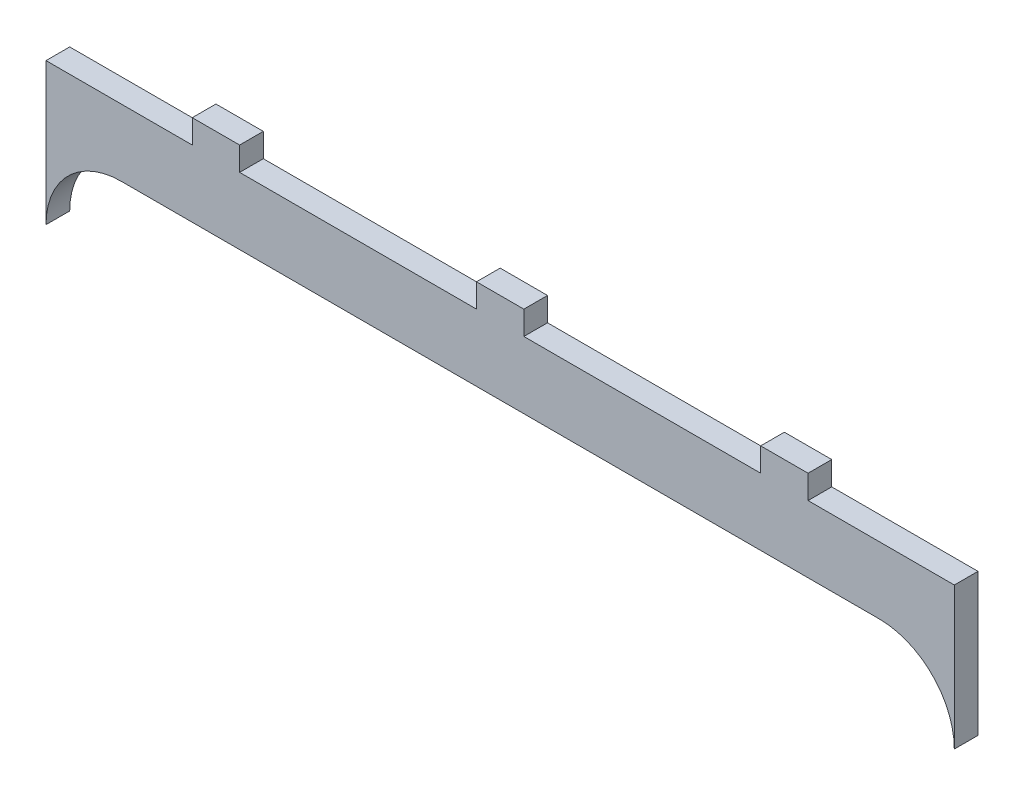
from build123d import *

# Parameters (mm, degrees)
BOSS_EXTRUDE1_DEPTH = 2.5


with BuildPart() as part:
    # Sketch1 → Boss-Extrude1 (new, symmetric)
    with BuildSketch(Plane.XY):
        with BuildLine():
            ThreePointArc((-95.875, 0), (-91.225320151, 11.225320151), (-80, 15.875))
            Line((-80, 15.875), (80, 15.875))
            ThreePointArc((80, 15.875), (91.225320151, 11.225320151), (95.875, 0))
            Line((95.875, 0), (95.875, 30))
            Line((95.875, 30), (65, 30))
            Line((65, 30), (65, 35))
            Line((65, 35), (55, 35))
            Line((55, 35), (55, 30))
            Line((55, 30), (5, 30))
            Line((5, 30), (5, 35))
            Line((5, 35), (-5, 35))
            Line((-5, 35), (-5, 30))
            Line((-5, 30), (-55, 30))
            Line((-55, 30), (-55, 35))
            Line((-55, 35), (-65, 35))
            Line((-65, 35), (-65, 30))
            Line((-65, 30), (-95.875, 30))
            Line((-95.875, 30), (-95.875, 0))
        make_face()
    extrude(amount=BOSS_EXTRUDE1_DEPTH, both=True)


solid = part.part
